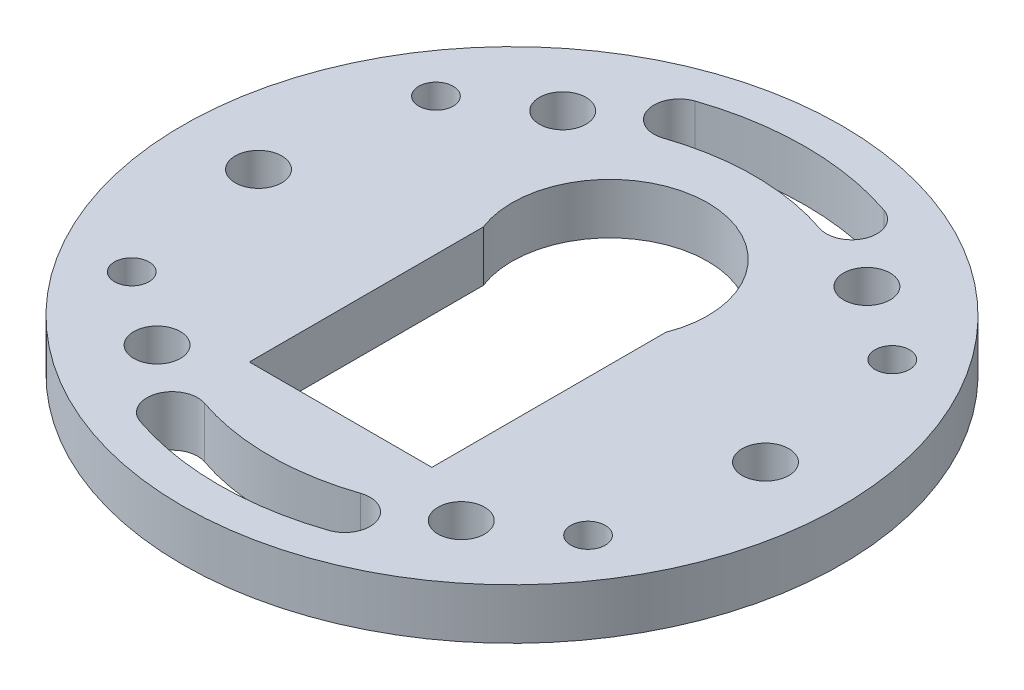
from build123d import *

# Parameters (mm, degrees)
SKETCH1_R           = 32.5
SKETCH1_R_2         = 2.3
SKETCH1_R_3         = 1.7
BOSS_EXTRUDE1_DEPTH = 5


with BuildPart() as part:
    # Sketch1 → Boss-Extrude1 (new body)
    with BuildSketch(Plane(origin=(0, 0, 0), x_dir=(1, 0, 0), z_dir=(0, 1, 0))):
        with Locations(Location((0, 0, 0), (0, 0, 270))):
            Circle(SKETCH1_R)
        with Locations(Location((-15, 20, 0), (0, 0, 270))):
            Circle(SKETCH1_R_2, mode=Mode.SUBTRACT)
        with Locations(Location((-22.5, 15, 0), (0, 0, 270))):
            Circle(SKETCH1_R_3, mode=Mode.SUBTRACT)
        with Locations(Location((-15, -20, 0), (0, 0, 270))):
            Circle(SKETCH1_R_2, mode=Mode.SUBTRACT)
        with Locations(Location((-25, 0, 0), (0, 0, 270))):
            Circle(SKETCH1_R_2, mode=Mode.SUBTRACT)
        with Locations(Location((-22.5, -15, 0), (0, 0, 270))):
            Circle(SKETCH1_R_3, mode=Mode.SUBTRACT)
        with Locations(Location((15, -20, 0), (0, 0, 90))):
            Circle(SKETCH1_R_2, mode=Mode.SUBTRACT)
        with Locations(Location((22.5, -15, 0), (0, 0, 90))):
            Circle(SKETCH1_R_3, mode=Mode.SUBTRACT)
        with Locations(Location((25, 0, 0), (0, 0, 90))):
            Circle(SKETCH1_R_2, mode=Mode.SUBTRACT)
        with Locations(Location((22.5, 15, 0), (0, 0, 90))):
            Circle(SKETCH1_R_3, mode=Mode.SUBTRACT)
        with Locations(Location((15, 20, 0), (0, 0, 90))):
            Circle(SKETCH1_R_2, mode=Mode.SUBTRACT)
        with BuildLine():
            Line((-9, 6.168261928), (-9, -16.9))
            Line((-9, -16.9), (9, -16.9))
            Line((9, -16.9), (9, 6.168261928))
            ThreePointArc((9, 6.168261928), (0, 19.3), (-9, 6.168261928))
        make_face(mode=Mode.SUBTRACT)
        with BuildLine():
            ThreePointArc((7.695243167, 22.633068138), (10.866931862, 24.195243167), (9.304756833, 27.366931862))
            ThreePointArc((9.304756833, 27.366931862), (0, 28.905491853), (-9.304756833, 27.366931862))
            ThreePointArc((-9.304756833, 27.366931862), (-10.866931862, 24.195243167), (-7.695243167, 22.633068138))
            ThreePointArc((-7.695243167, 22.633068138), (0, 23.905491853), (7.695243167, 22.633068138))
        make_face(mode=Mode.SUBTRACT)
        with BuildLine():
            ThreePointArc((7.695243167, -22.633068138), (10.866931862, -24.195243167), (9.304756833, -27.366931862))
            ThreePointArc((9.304756833, -27.366931862), (0, -28.905491853), (-9.304756833, -27.366931862))
            ThreePointArc((-9.304756833, -27.366931862), (-10.866931862, -24.195243167), (-7.695243167, -22.633068138))
            ThreePointArc((-7.695243167, -22.633068138), (0, -23.905491853), (7.695243167, -22.633068138))
        make_face(mode=Mode.SUBTRACT)
    extrude(amount=BOSS_EXTRUDE1_DEPTH)


solid = part.part
